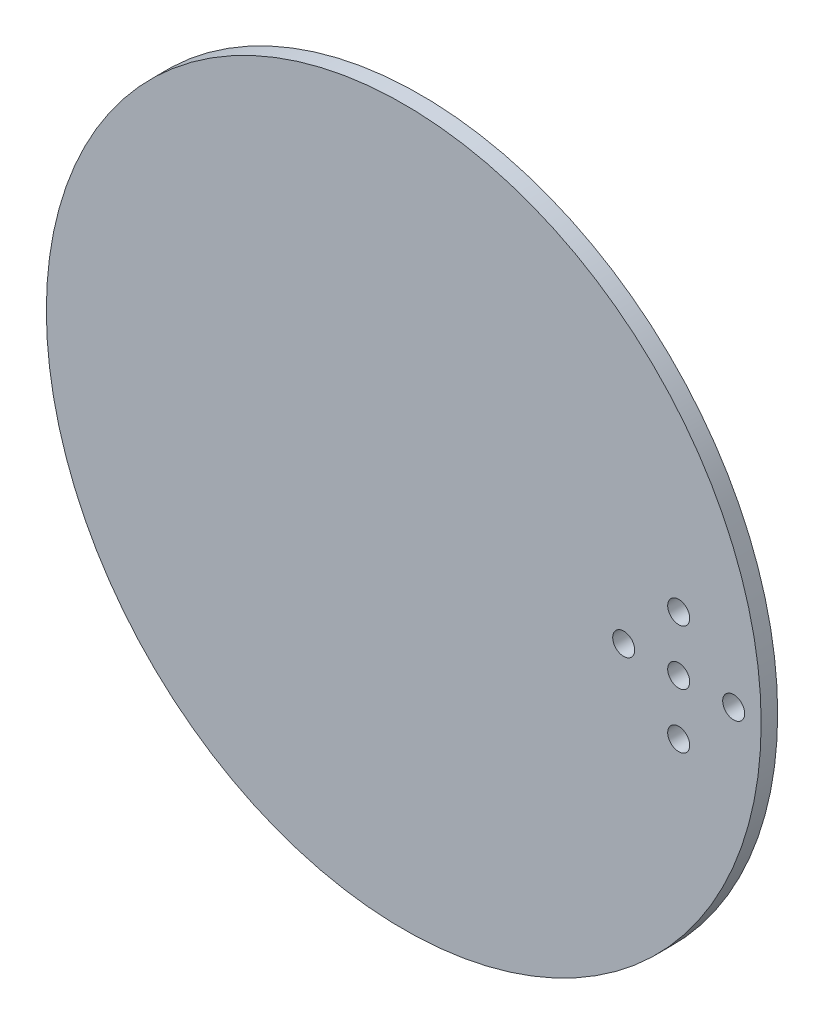
from build123d import *

# Parameters (mm, degrees)
SKETCH_1_R          = 65
EXTRUDE_1_DEPTH     = 3
SKETCH_2_R          = 2
SKETCH_2_R_2        = 1.5
CUT_EXTRUDE_4_DEPTH = 3


with BuildPart() as part:
    # 草图1 → 凸台-拉伸1 (new body)
    with BuildSketch(Plane.XY):
        Circle(SKETCH_1_R)
    extrude(amount=EXTRUDE_1_DEPTH)

    # 草图2 → 切除-拉伸4 (cut)
    with BuildSketch(Plane.XY.offset(3)):
        with Locations((40, 0)):
            Circle(SKETCH_2_R)
        with Locations((50, -10)):
            Circle(SKETCH_2_R)
        with Locations((50, 0)):
            Circle(SKETCH_2_R_2)
        with Locations((50, 0)):
            Circle(SKETCH_2_R)
        with Locations((50, 10)):
            Circle(SKETCH_2_R)
        with Locations((60, 0)):
            Circle(SKETCH_2_R)
    extrude(amount=-CUT_EXTRUDE_4_DEPTH, mode=Mode.SUBTRACT)


solid = part.part
